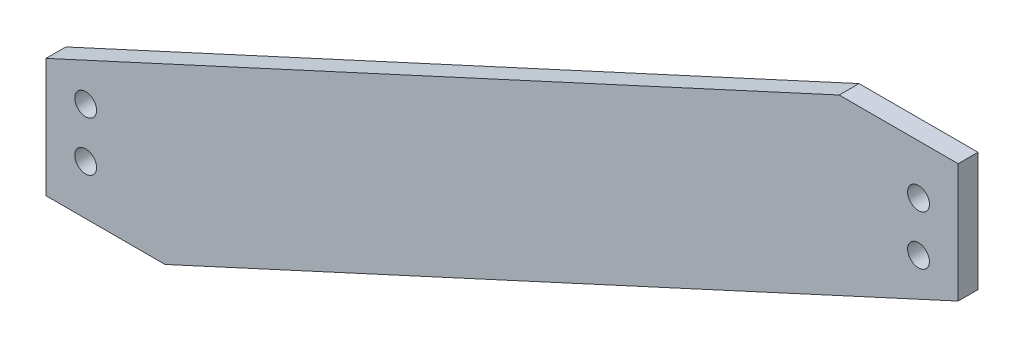
from build123d import *

# Parameters (mm, degrees)
BOSS_EXTRUDE1_DEPTH  = 5
BOSS_EXTRUDE2_DEPTH  = 5
M5_CLEARANCE_HOLE1_D = 5.5


with BuildPart() as part:
    # Sketch1 → Boss-Extrude1 (new body)
    with BuildSketch(Plane.XY):
        Polygon((0, 0), (20, 0), (230, 122), (210, 122), align=None)
    extrude(amount=BOSS_EXTRUDE1_DEPTH)

    # Sketch2 → Boss-Extrude2 (add)
    with BuildSketch(Plane.XY.offset(5)):
        Polygon((0, 0), (0, 30), (200, 122), (210, 122), (230, 122), (230, 92), (30, 0), align=None)
    extrude(amount=-BOSS_EXTRUDE2_DEPTH)

    # M5 Clearance Hole1 (through all)
    with Locations(Plane.XY.offset(5)):
        with Locations((10, 25), (220, 97), (10, 12.5), (220, 109.5)):
            Hole(M5_CLEARANCE_HOLE1_D / 2)


solid = part.part
